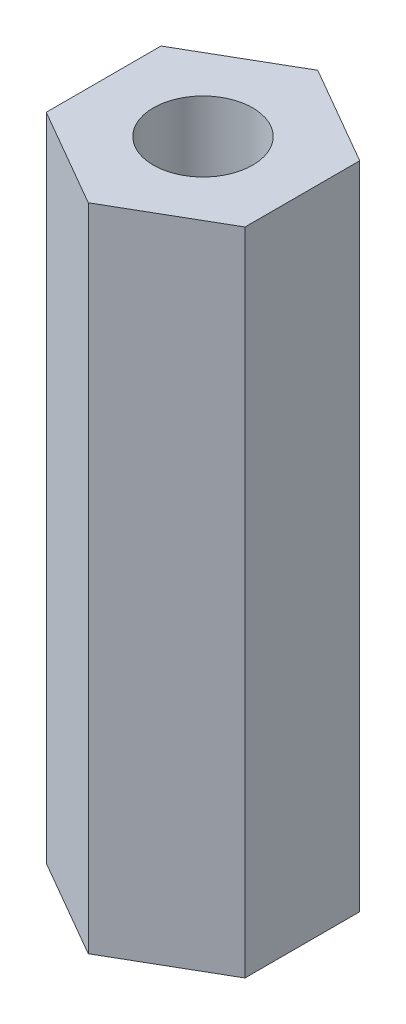
from build123d import *

# Parameters (mm, degrees)
SKETCH1_R           = 1.375
BOSS_EXTRUDE1_DEPTH = 18


with BuildPart() as part:
    # Sketch1 → Boss-Extrude1 (new body)
    with BuildSketch(Plane(origin=(0, 0, 0), x_dir=(1, 0, 0), z_dir=(0, 1, 0))):
        Polygon((-2.75, 1.58771324), (-2.75, -1.58771324), (0, -3.175426481), (2.75, -1.58771324), (2.75, 1.58771324), (0, 3.175426481), align=None)
        with Locations(Location((0, 0, 0), (0, 0, 270))):
            Circle(SKETCH1_R, mode=Mode.SUBTRACT)
    extrude(amount=BOSS_EXTRUDE1_DEPTH)


solid = part.part
